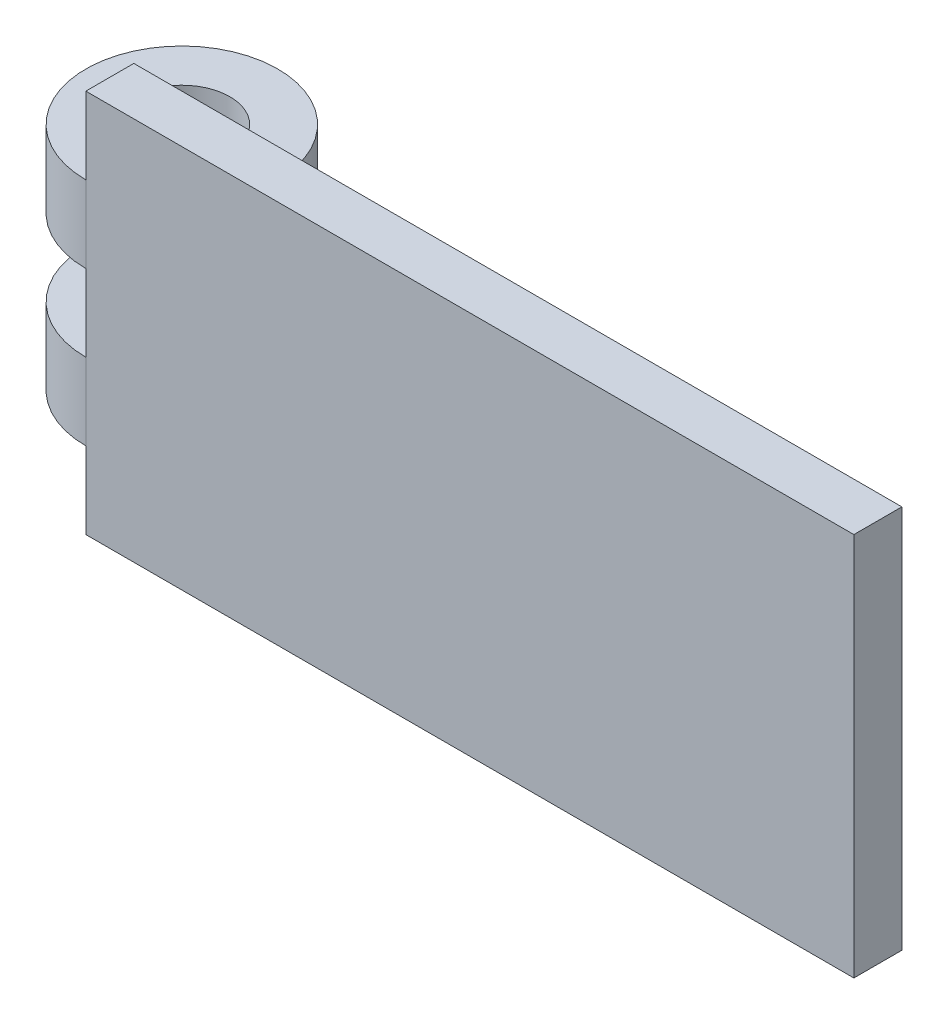
from build123d import *

# Parameters (mm, degrees)
SKETCH1_W           = 50.8
SKETCH1_H           = 3.175
BOSS_EXTRUDE1_DEPTH = 25.4
SKETCH2_R           = 6.35
SKETCH2_R_2         = 3.175
BOSS_EXTRUDE2_DEPTH = 5.08
LPATTERN1_COUNT     = 2
LPATTERN1_PITCH     = 10.16


with BuildPart() as part:
    # Sketch1 → Boss-Extrude1 (new body)
    with BuildSketch(Plane(origin=(0, 0, 0), x_dir=(1, 0, 0), z_dir=(0, 1, 0))):
        with Locations((25.4, 1.5875)):
            Rectangle(SKETCH1_W, SKETCH1_H)
    extrude(amount=BOSS_EXTRUDE1_DEPTH)

    # Sketch2 → Boss-Extrude2 (add)
    with BuildSketch(Plane(origin=(0, 20.32, 0), x_dir=(1, 0, 0), z_dir=(0, 1, 0))):
        with Locations((0, 6.35)):
            Circle(SKETCH2_R)
        with Locations(Location((0, 6.35, 0), (0, 0, 270))):
            Circle(SKETCH2_R_2, mode=Mode.SUBTRACT)
    boss_extrude2 = extrude(amount=-BOSS_EXTRUDE2_DEPTH)

    # LPattern1: Boss-Extrude2 ×2
    with Locations(*[(0, -i * LPATTERN1_PITCH, 0) for i in range(1, LPATTERN1_COUNT)]):
        add(boss_extrude2)


solid = part.part
